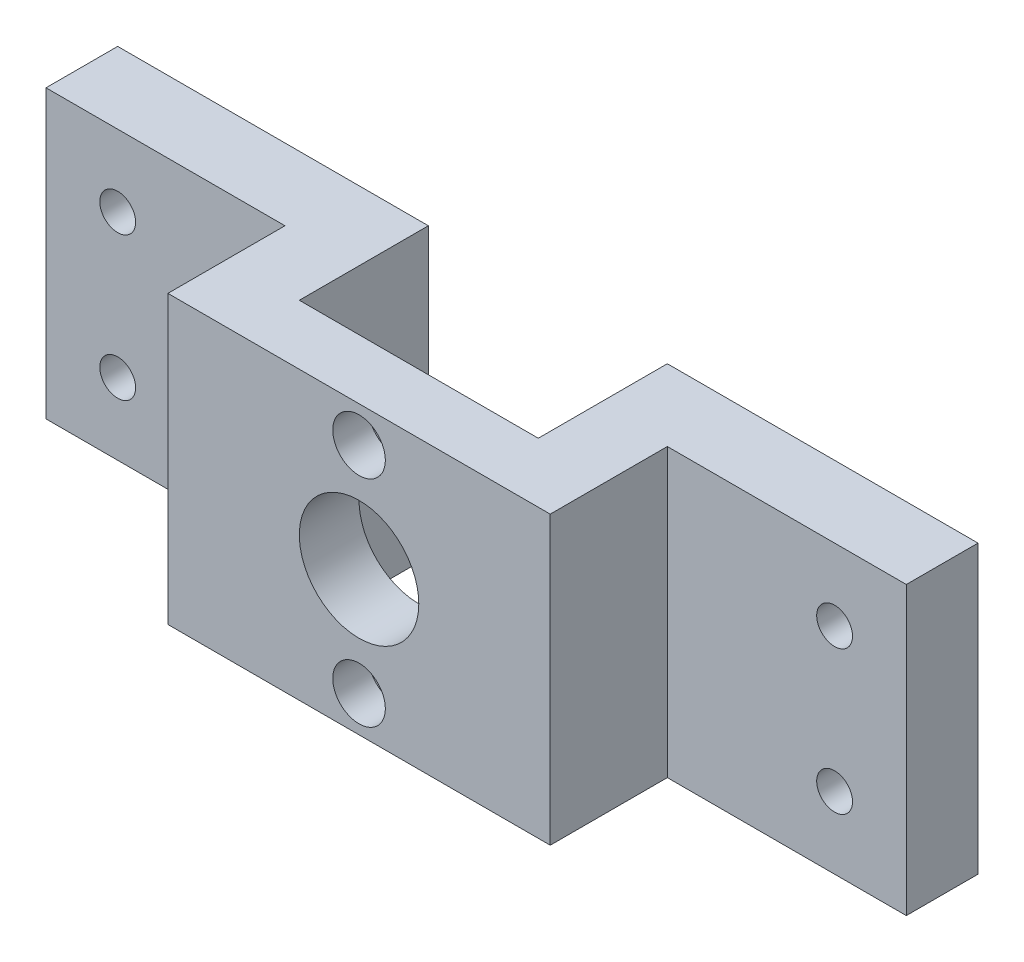
from build123d import *

# Parameters (mm, degrees)
SKETCH_1_W          = 10
SKETCH_1_H          = 12
SKETCH_1_R          = 0.85
SKETCH_1_R_2        = 2.5
EXTRUDE_1_DEPTH     = 1.25
CUT_EXTRUDE_START   = 1.25
SKETCH_1_6_R        = 1.1
CUT_EXTRUDE_1_DEPTH = 1.5
SKETCH_2_W          = 3
SKETCH_2_H          = 12
EXTRUDE_2_DEPTH     = 7.9
SKETCH_3_W          = 10
SKETCH_3_H          = 3
EXTRUDE_3_DEPTH     = 12
SKETCH_4_R          = 0.75
CUT_EXTRUDE_2_DEPTH = 21.552615405
SKETCH_4_3_R        = 1.5
CUT_EXTRUDE_3_DEPTH = 1.5


with BuildPart() as part:
    # 草图1 → 凸台-拉伸1 (new, symmetric)
    with BuildSketch(Plane.XY):
        Rectangle(SKETCH_1_W, SKETCH_1_H)
        with Locations((0, 4.5)):
            Circle(SKETCH_1_R, mode=Mode.SUBTRACT)
        with Locations((0, -4.5)):
            Circle(SKETCH_1_R, mode=Mode.SUBTRACT)
        Circle(SKETCH_1_R_2, mode=Mode.SUBTRACT)
    extrude(amount=EXTRUDE_1_DEPTH, both=True)

    # 草图1<6> → 切除-拉伸1 (cut)
    with BuildSketch(Plane.XY.offset(CUT_EXTRUDE_START)):
        with Locations((0, 4.5)):
            Circle(SKETCH_1_6_R)
        with Locations((0, -4.5)):
            Circle(SKETCH_1_6_R)
    extrude(amount=-CUT_EXTRUDE_1_DEPTH, mode=Mode.SUBTRACT)

    # 草图2 → 凸台-拉伸2 (add)
    with BuildSketch(Plane.XY.offset(1.25)):
        with Locations((6.5, 0)):
            Rectangle(SKETCH_2_W, SKETCH_2_H)
        with Locations((-6.5, 0)):
            Rectangle(SKETCH_2_W, SKETCH_2_H)
    extrude(amount=-EXTRUDE_2_DEPTH)

    # 草图3 → 凸台-拉伸3 (add)
    with BuildSketch(Plane(origin=(0, 6, 0), x_dir=(1, 0, 0), z_dir=(0, 1, 0))):
        with Locations((-13, 5.15)):
            Rectangle(SKETCH_3_W, SKETCH_3_H)
        with Locations((13, 5.15)):
            Rectangle(SKETCH_3_W, SKETCH_3_H)
    extrude(amount=-EXTRUDE_3_DEPTH)

    # 草图4 → 切除-拉伸2 (cut, through all)
    with BuildSketch(Plane(origin=(0, 0, -6.65), x_dir=(-1, 0, 0), z_dir=(0, 0, -1))):
        with Locations((15, -3)):
            Circle(SKETCH_4_R)
        with Locations((15, 3)):
            Circle(SKETCH_4_R)
        with Locations((-15, -3)):
            Circle(SKETCH_4_R)
        with Locations((-15, 3)):
            Circle(SKETCH_4_R)
    extrude(amount=-CUT_EXTRUDE_2_DEPTH, mode=Mode.SUBTRACT)

    # 草图4<3> → 切除-拉伸3 (cut)
    with BuildSketch(Plane(origin=(0, 0, -6.65), x_dir=(-1, 0, 0), z_dir=(0, 0, -1))):
        with Locations((15, 3)):
            Circle(SKETCH_4_3_R)
        with Locations((15, -3)):
            Circle(SKETCH_4_3_R)
        with Locations((-15, 3)):
            Circle(SKETCH_4_3_R)
        with Locations((-15, -3)):
            Circle(SKETCH_4_3_R)
    extrude(amount=-CUT_EXTRUDE_3_DEPTH, mode=Mode.SUBTRACT)


solid = part.part
